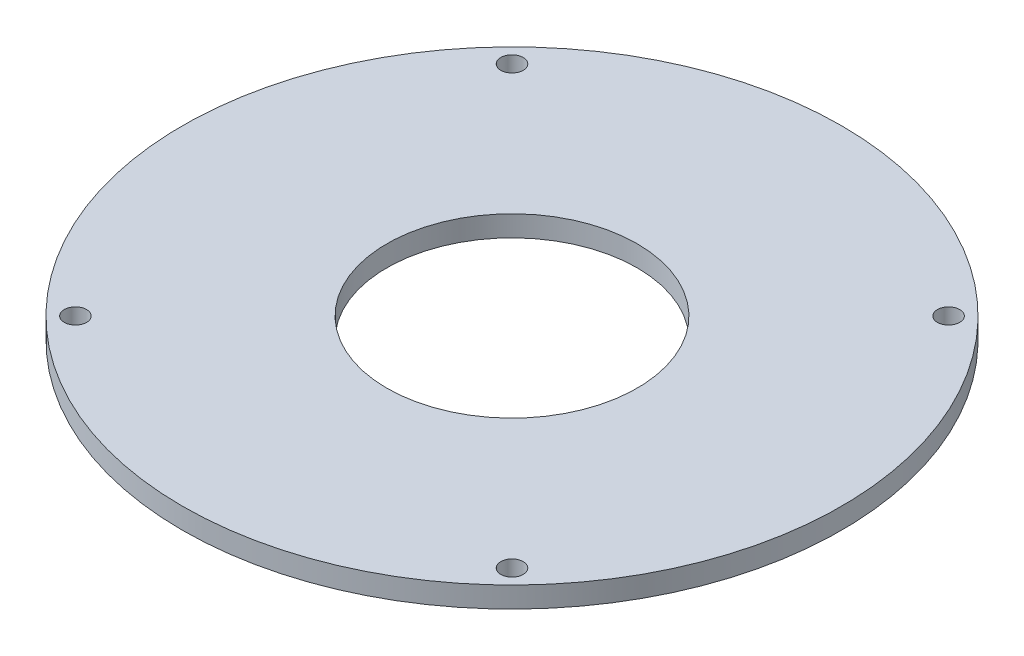
from build123d import *

# Parameters (mm, degrees)
SKETCH1_R            = 50.165
SKETCH1_R_2          = 19.05
BOSS_EXTRUDE1_DEPTH  = 1.5875
M3_CLEARANCE_HOLE1_D = 3.4


with BuildPart() as part:
    # Sketch1 → Boss-Extrude1 (new, symmetric)
    with BuildSketch(Plane(origin=(0, 0, 0), x_dir=(1, 0, 0), z_dir=(0, 1, 0))):
        with Locations(Location((0, 0, 0), (0, 0, 270))):
            Circle(SKETCH1_R)
        with Locations(Location((0, 0, 0), (0, 0, 270))):
            Circle(SKETCH1_R_2, mode=Mode.SUBTRACT)
    extrude(amount=BOSS_EXTRUDE1_DEPTH, both=True)

    # M3 Clearance Hole1 (through all)
    with Locations(Plane(origin=(0, 1.5875, 0), x_dir=(1, 0, 0), z_dir=(0, 1, 0))):
        with Locations((-33.226947648, -33.226947648), (-33.226947648, 33.226947648), (33.226947648, 33.226947648), (33.226947648, -33.226947648)):
            Hole(M3_CLEARANCE_HOLE1_D / 2)


solid = part.part
